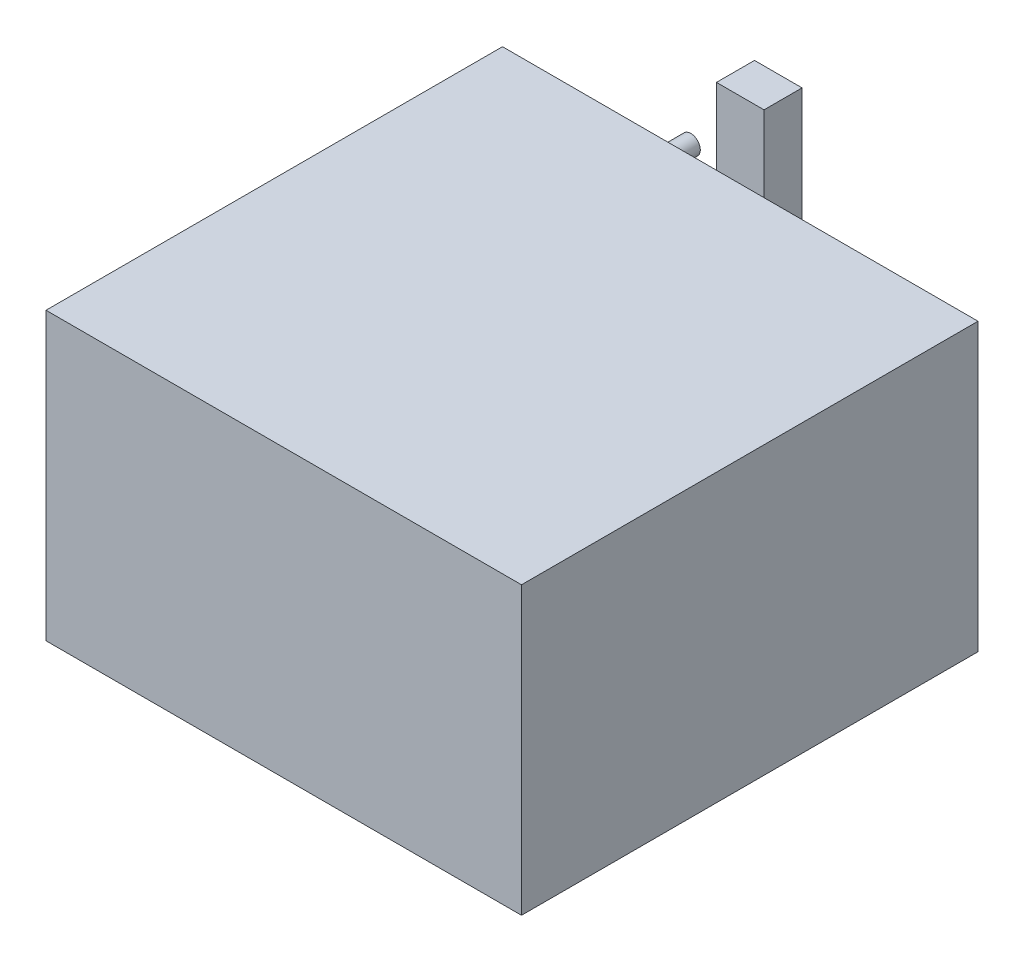
from build123d import *

# Parameters (mm, degrees)
SKETCH_2_W      = 25.0000008
SKETCH_2_H      = 15.04999784
EXTRUDE_2_DEPTH = 24
SKETCH_3_R      = 0.5
EXTRUDE_3_DEPTH = 5
SKETCH_4_W      = 2.5
SKETCH_4_H      = 7
EXTRUDE_4_DEPTH = 2


with BuildPart() as part:
    # Эскиз2 → Бобышка-Вытянуть2 (new body)
    with BuildSketch(Plane.XY):
        with Locations((-17.07912528, 17.543231945)):
            Rectangle(SKETCH_2_W, SKETCH_2_H)
    extrude(amount=EXTRUDE_2_DEPTH)

    # Эскиз3 → Бобышка-Вытянуть3 (add)
    with BuildSketch(Plane(origin=(0, 0, 0), x_dir=(-1, 0, 0), z_dir=(0, 0, -1))):
        with Locations(Location((24.67912568, 20.568230865, 0), (0, 0, 180))):
            Circle(SKETCH_3_R)
        with Locations(Location((24.67912568, 14.568230865, 0), (0, 0, 180))):
            Circle(SKETCH_3_R)
    extrude(amount=EXTRUDE_3_DEPTH)

    # Эскиз4 → Бобышка-Вытянуть4 (add)
    with BuildSketch(Plane(origin=(0, 0, 0), x_dir=(-1, 0, 0), z_dir=(0, 0, -1))):
        with Locations((17.07912488, 25.568230865)):
            Rectangle(SKETCH_4_W, SKETCH_4_H)
        with Locations((17.07912488, 9.518233025)):
            Rectangle(SKETCH_4_W, SKETCH_4_H)
    extrude(amount=EXTRUDE_4_DEPTH)


solid = part.part
